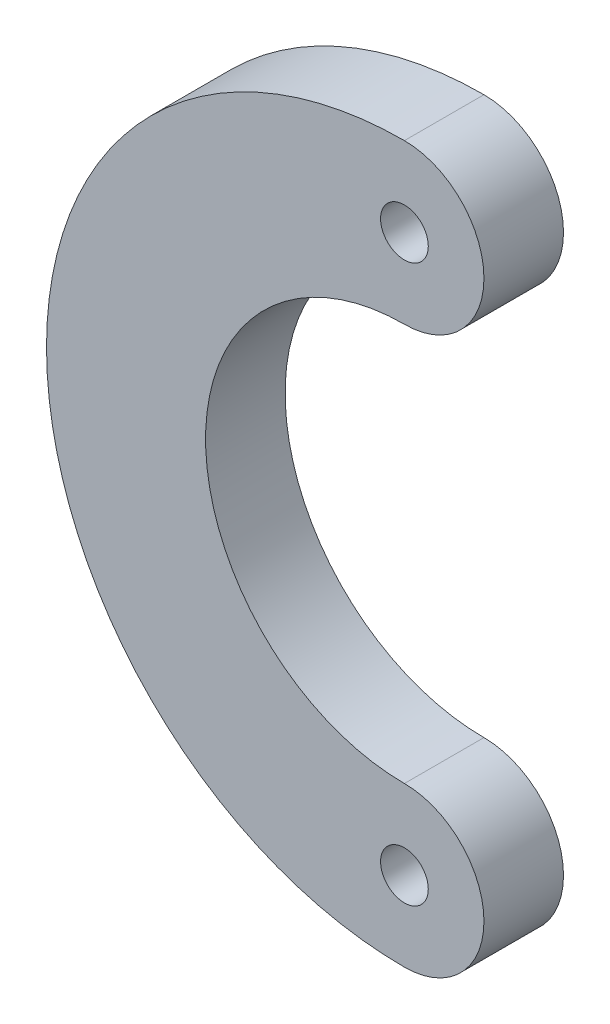
from build123d import *

# Parameters (mm, degrees)
BOSS_EXTRUDE1_DEPTH   = 5
F_3_0MM_DOWEL_HOLE1_D = 3


with BuildPart() as part:
    # Sketch1 → Boss-Extrude1 (new body)
    with BuildSketch(Plane.XY):
        with BuildLine():
            ThreePointArc((0, 22.5), (-22.5, 0), (0, -22.5))
            ThreePointArc((0, -22.5), (5, -17.5), (0, -12.5))
            ThreePointArc((0, -12.5), (-12.5, 0), (0, 12.5))
            ThreePointArc((0, 12.5), (5, 17.5), (0, 22.5))
        make_face()
    extrude(amount=BOSS_EXTRUDE1_DEPTH)

    # Ø3.0mm Dowel Hole1 (through all)
    with Locations(Plane.XY.offset(5)):
        with Locations((0, 17.5), (0, -17.5)):
            Hole(F_3_0MM_DOWEL_HOLE1_D / 2)


solid = part.part
